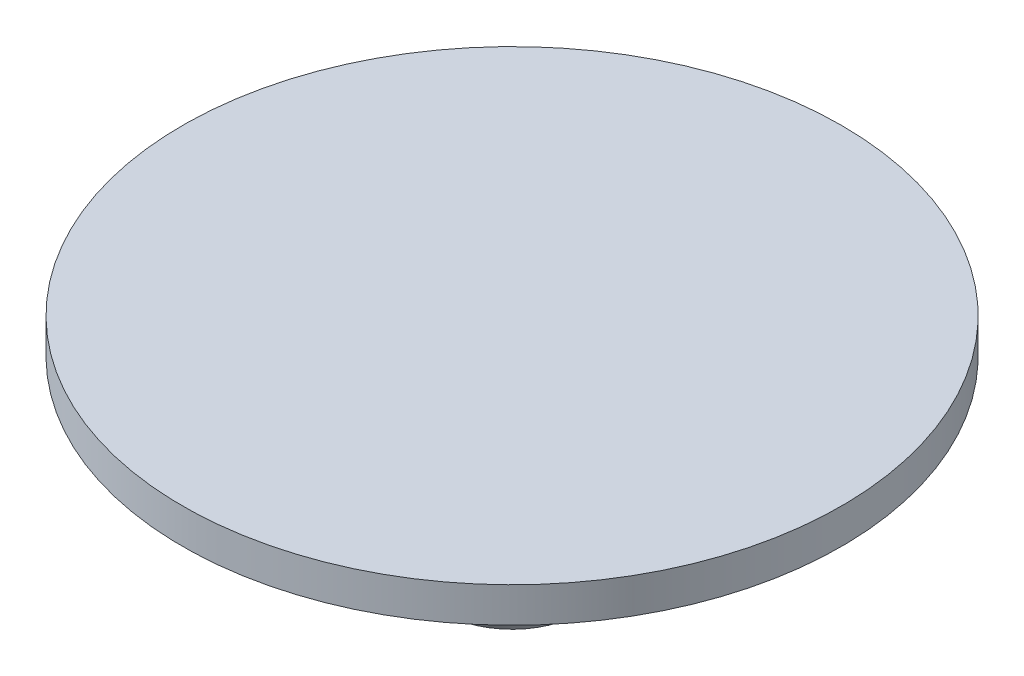
from build123d import *

# Parameters (mm, degrees)
SKETCH2_R          = 1.25
CUT_EXTRUDE1_DEPTH = 10


with BuildPart() as part:
    # Sketch1 → Revolve1 (revolve)
    with BuildSketch(Plane.XY, mode=Mode.PRIVATE) as revolve1_sk:
        Polygon((0, 0), (14.1, 0), (14.1, -1.5), (6.85, -1.5), (3, -9.5), (2, -9.5), (2, -1.5), (0, -1.5), align=None)
    revolve(revolve1_sk.sketch.rotate(Axis((0, -1.5, 0), (0, 1, 0)), 90), axis=Axis((0, -1.5, 0), (0, 1, 0)))

    # Sketch2 → Cut-Extrude1 (cut)
    with BuildSketch(Plane.XY):
        with Locations(Location((0, -5.6, 0), (0, 0, 270.000000049))):
            Circle(SKETCH2_R)
    extrude(amount=-CUT_EXTRUDE1_DEPTH, mode=Mode.SUBTRACT)


solid = part.part
